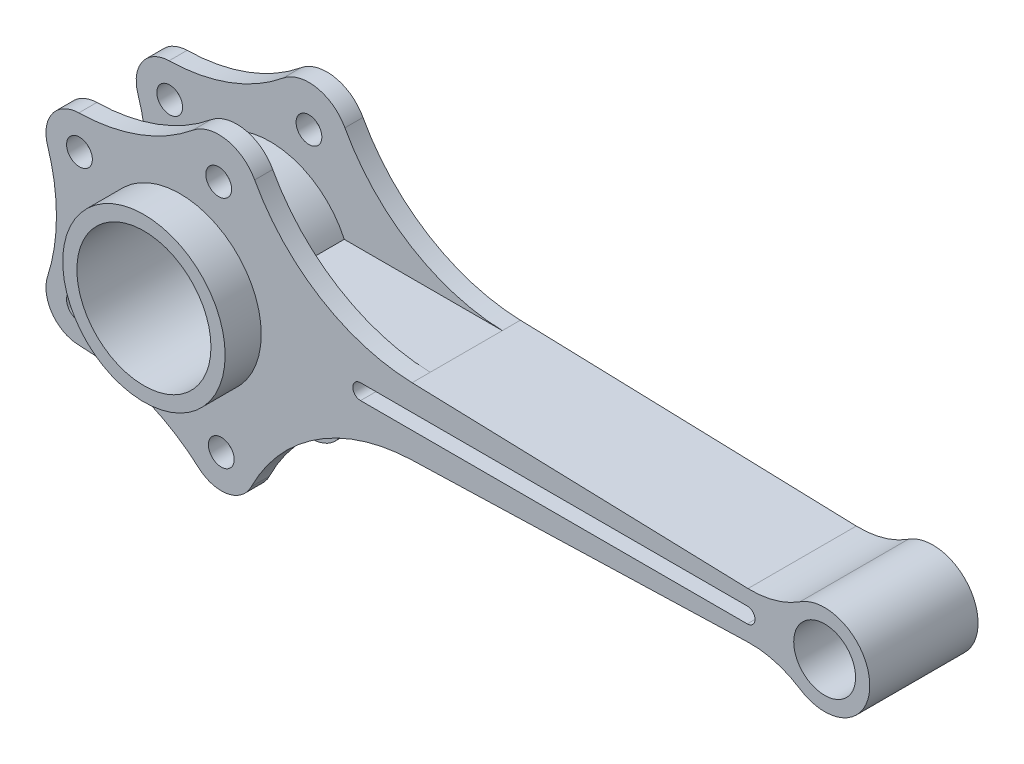
from build123d import *

# Parameters (mm, degrees)
SKETCH1_R           = 31.5
SKETCH1_R_2         = 26
BOSS_EXTRUDE1_DEPTH = 35
SKETCH1_9_W         = 20
SKETCH1_9_H         = 6
SKETCH1_9_R         = 12
BOSS_EXTRUDE2_DEPTH = 21
BOSS_EXTRUDE4_START = -21
SKETCH1_13_W        = 20
SKETCH1_13_H        = 6
BOSS_EXTRUDE4_DEPTH = 42
FILLET1_R           = 72
CUT_EXTRUDE1_START  = -2.5
SKETCH1_10_W        = 150
SKETCH1_10_H        = 6
CUT_EXTRUDE1_DEPTH  = 270.112775841
SKETCH1_11_R        = 5
BOSS_EXTRUDE3_DEPTH = 21
SKETCH1_12_R        = 5
CUT_EXTRUDE2_DEPTH  = 14


with BuildPart() as part:
    # Sketch1 → Boss-Extrude1 (new, symmetric)
    with BuildSketch(Plane.XY):
        Circle(SKETCH1_R)
        Circle(SKETCH1_R_2, mode=Mode.SUBTRACT)
    extrude(amount=BOSS_EXTRUDE1_DEPTH, both=True)

    # Sketch1<9> → Boss-Extrude2 (add, symmetric)
    with BuildSketch(Plane.XY):
        with BuildLine():
            ThreePointArc((240.444891614, 14.661169931), (230.786453061, 10.283897205), (220.260411081, 9))
            Line((220.260411081, 9), (90, 13))
            Line((90, 13), (28.692333471, 13))
            ThreePointArc((28.692333471, 13), (31.5, 0), (28.692333471, -13))
            Line((28.692333471, -13), (90, -13))
            Line((90, -13), (220.260411081, -9))
            ThreePointArc((220.260411081, -9), (230.786453061, -10.283897205), (240.444891614, -14.661169931))
            ThreePointArc((240.444891614, -14.661169931), (267.5, 0), (240.444891614, 14.661169931))
        make_face()
        with Locations((80, 0)):
            Rectangle(SKETCH1_9_W, SKETCH1_9_H, mode=Mode.SUBTRACT)
        with Locations(Location((250, 0, 0), (0, 0, 180))):
            Circle(SKETCH1_9_R, mode=Mode.SUBTRACT)
    extrude(amount=BOSS_EXTRUDE2_DEPTH, both=True)

    # Sketch1<13> → Boss-Extrude4 (add)
    with BuildSketch(Plane.XY.offset(BOSS_EXTRUDE4_START)):
        with Locations((80, 0)):
            Rectangle(SKETCH1_13_W, SKETCH1_13_H)
    extrude(amount=BOSS_EXTRUDE4_DEPTH)

    # Fillet1
    fillet1_edges = [part.edges().sort_by_distance(p)[0] for p in [
        (28.692333471, 13, 0),
        (28.692333471, -13, 0),
    ]]
    fillet(fillet1_edges, radius=FILLET1_R)

    # Sketch1<10> → Cut-Extrude1 (cut, through all)
    with BuildSketch(Plane.XY.offset(CUT_EXTRUDE1_START)):
        with Locations((145, 0)):
            Rectangle(SKETCH1_10_W, SKETCH1_10_H)
        with BuildLine():
            ThreePointArc((220, 3), (223, 0), (220, -3))
            Line((220, -3), (220, 3))
        make_face()
        with BuildLine():
            Line((70, -3), (70, 3))
            ThreePointArc((70, 3), (67, 0), (70, -3))
        make_face()
    cut_extrude1 = extrude(amount=-CUT_EXTRUDE1_DEPTH, mode=Mode.SUBTRACT)

    # Mirror1: Cut-Extrude1 across plane
    add(cut_extrude1.mirror(Plane.XY), mode=Mode.SUBTRACT)

    # Sketch1<11> → Boss-Extrude3 (add, symmetric)
    with BuildSketch(Plane.XY):
        with BuildLine():
            Line((28.692333471, 13), (90, 13))
            ThreePointArc((90, 13), (54.465075477, 23.652725045), (28.950381961, 50.582482314))
            ThreePointArc((28.950381961, 50.582482314), (18.050555131, 58.582082925), (4.938808192, 55.283306326))
            ThreePointArc((4.938808192, 55.283306326), (-15.790013542, 43.424058768), (-39.257670087, 38.997446139))
            ThreePointArc((-39.257670087, 38.997446139), (-49.580007549, 33.5540347), (-51.376901133, 22.023529412))
            ThreePointArc((-51.376901133, 22.023529412), (-47.925892025, 0), (-51.376901133, -22.023529412))
            ThreePointArc((-51.376901133, -22.023529412), (-49.563579479, -33.576990734), (-39.201221462, -38.998442596))
            ThreePointArc((-39.201221462, -38.998442596), (-14.290092236, -43.85808942), (7.387013832, -57.059740797))
            ThreePointArc((7.387013832, -57.059740797), (18.504940725, -60.078747549), (27.655633909, -53.079639433))
            ThreePointArc((27.655633909, -53.079639433), (53.274598705, -24.401721259), (90, -13))
            Line((90, -13), (28.692333471, -13))
            ThreePointArc((28.692333471, -13), (-31.5, 0), (28.692333471, 13))
        make_face()
        with Locations(Location((16, -47.322365932, 0), (0, 0, 180))):
            Circle(SKETCH1_11_R, mode=Mode.SUBTRACT)
        with Locations(Location((-39, -26, 0), (0, 0, 180))):
            Circle(SKETCH1_11_R, mode=Mode.SUBTRACT)
        with Locations(Location((-39, 26, 0), (0, 0, 180))):
            Circle(SKETCH1_11_R, mode=Mode.SUBTRACT)
        with Locations(Location((15, 43, 0), (0, 0, 180))):
            Circle(SKETCH1_11_R, mode=Mode.SUBTRACT)
    extrude(amount=BOSS_EXTRUDE3_DEPTH, both=True)

    # Sketch1<12> → Cut-Extrude2 (cut, symmetric)
    with BuildSketch(Plane.XY):
        with BuildLine():
            Line((28.692333471, 13), (90, 13))
            ThreePointArc((90, 13), (54.465075477, 23.652725045), (28.950381961, 50.582482314))
            ThreePointArc((28.950381961, 50.582482314), (18.050555131, 58.582082925), (4.938808192, 55.283306326))
            ThreePointArc((4.938808192, 55.283306326), (-15.790013542, 43.424058768), (-39.257670087, 38.997446139))
            ThreePointArc((-39.257670087, 38.997446139), (-49.580007549, 33.5540347), (-51.376901133, 22.023529412))
            ThreePointArc((-51.376901133, 22.023529412), (-47.925892025, 0), (-51.376901133, -22.023529412))
            ThreePointArc((-51.376901133, -22.023529412), (-49.563579479, -33.576990734), (-39.201221462, -38.998442596))
            ThreePointArc((-39.201221462, -38.998442596), (-14.290092236, -43.85808942), (7.387013832, -57.059740797))
            ThreePointArc((7.387013832, -57.059740797), (18.504940725, -60.078747549), (27.655633909, -53.079639433))
            ThreePointArc((27.655633909, -53.079639433), (53.274598705, -24.401721259), (90, -13))
            Line((90, -13), (28.692333471, -13))
            ThreePointArc((28.692333471, -13), (-31.5, 0), (28.692333471, 13))
        make_face()
        with Locations(Location((16, -47.322365932, 0), (0, 0, 180))):
            Circle(SKETCH1_12_R, mode=Mode.SUBTRACT)
        with Locations(Location((-39, -26, 0), (0, 0, 180))):
            Circle(SKETCH1_12_R, mode=Mode.SUBTRACT)
        with Locations(Location((-39, 26, 0), (0, 0, 180))):
            Circle(SKETCH1_12_R, mode=Mode.SUBTRACT)
        with Locations(Location((15, 43, 0), (0, 0, 180))):
            Circle(SKETCH1_12_R, mode=Mode.SUBTRACT)
    extrude(amount=CUT_EXTRUDE2_DEPTH, both=True, mode=Mode.SUBTRACT)


solid = part.part
